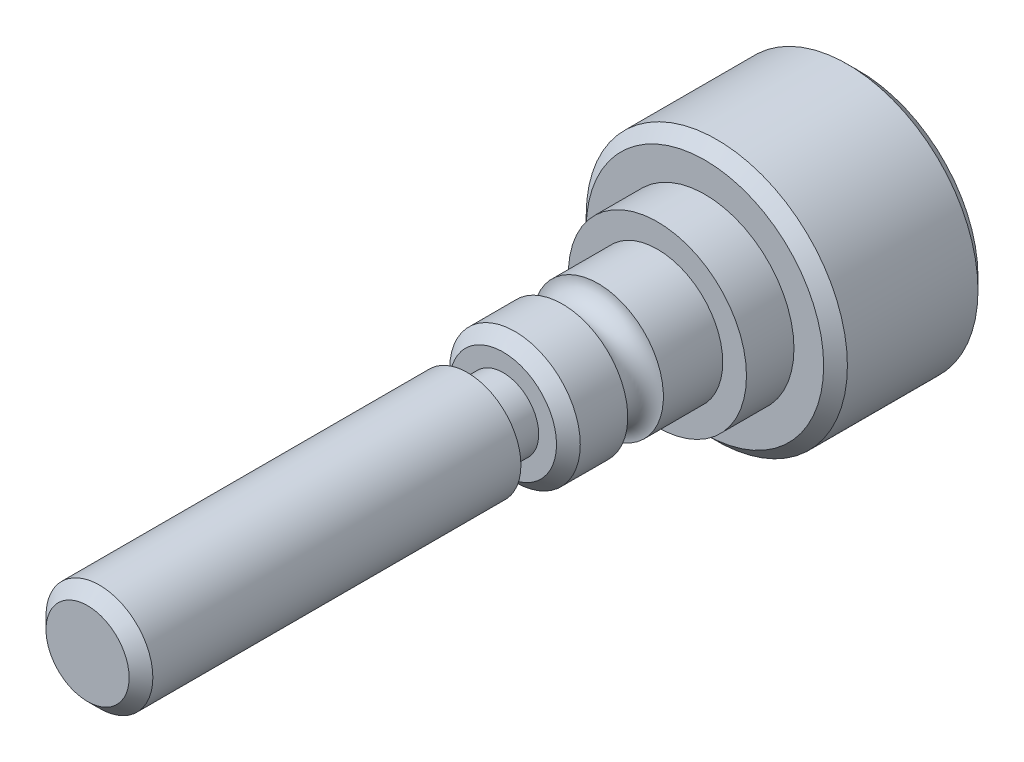
from build123d import *

# Parameters (mm, degrees)
ESBO_O1_R                = 11
RESSALTO_EXTRUS_O1_DEPTH = 13
ESBO_O2_R                = 7.5
RESSALTO_EXTRUS_O2_DEPTH = 4
ESBO_O3_R                = 5.5
RESSALTO_EXTRUS_O3_DEPTH = 13
ESBO_O4_R                = 3
RESSALTO_EXTRUS_O4_DEPTH = 3
ESBO_O5_R                = 4.5
RESSALTO_EXTRUS_O5_DEPTH = 32
CHANFRO1_SIZE            = 1
CHANFRO2_SIZE            = 1
ESBO_O6_R                = 1.5


with BuildPart() as part:
    # Esboço1 → Ressalto-extrusão1 (new body)
    with BuildSketch(Plane.XY):
        with Locations(Location((0, 0, 0), (0, 0, 180))):
            Circle(ESBO_O1_R)
    extrude(amount=RESSALTO_EXTRUS_O1_DEPTH)

    # Esboço2 → Ressalto-extrusão2 (add)
    with BuildSketch(Plane.XY.offset(13)):
        Circle(ESBO_O2_R)
    extrude(amount=RESSALTO_EXTRUS_O2_DEPTH)

    # Esboço3 → Ressalto-extrusão3 (add)
    with BuildSketch(Plane.XY.offset(17)):
        with Locations(Location((0, 0, 0), (0, 0, 180))):
            Circle(ESBO_O3_R)
    extrude(amount=RESSALTO_EXTRUS_O3_DEPTH)

    # Esboço4 → Ressalto-extrusão4 (add)
    with BuildSketch(Plane.XY.offset(30)):
        Circle(ESBO_O4_R)
    extrude(amount=RESSALTO_EXTRUS_O4_DEPTH)

    # Esboço5 → Ressalto-extrusão5 (add)
    with BuildSketch(Plane.XY.offset(33)):
        Circle(ESBO_O5_R)
    extrude(amount=RESSALTO_EXTRUS_O5_DEPTH)

    # Chanfro1
    chanfro1_edges = [part.edges().sort_by_distance(p)[0] for p in [
        (11, 0, 0),
    ]]
    chamfer(chanfro1_edges, length=CHANFRO1_SIZE)

    # Chanfro2
    chanfro2_edges = [part.edges().sort_by_distance(p)[0] for p in [
        (5.5, 0, 30),
        (-4.5, 0, 65),
        (11, 0, 13),
    ]]
    chamfer(chanfro2_edges, length=CHANFRO2_SIZE)

    # Varredura de corte1: sweep along a path in Esboço7
    with BuildLine(Plane.XY.offset(23.5)) as varredura_de_corte1_path:
        CenterArc((0, 0), 5.5, 0, 360)
    # Esboço6 → Varredura de corte1 (sweep, cut)
    with BuildSketch(Plane(origin=(0, 0, 0), x_dir=(1, 0, 0), z_dir=(0, 1, 0))):
        with Locations((-5.5, -23.5)):
            Circle(ESBO_O6_R)
    sweep(path=varredura_de_corte1_path.line, mode=Mode.SUBTRACT)


solid = part.part
